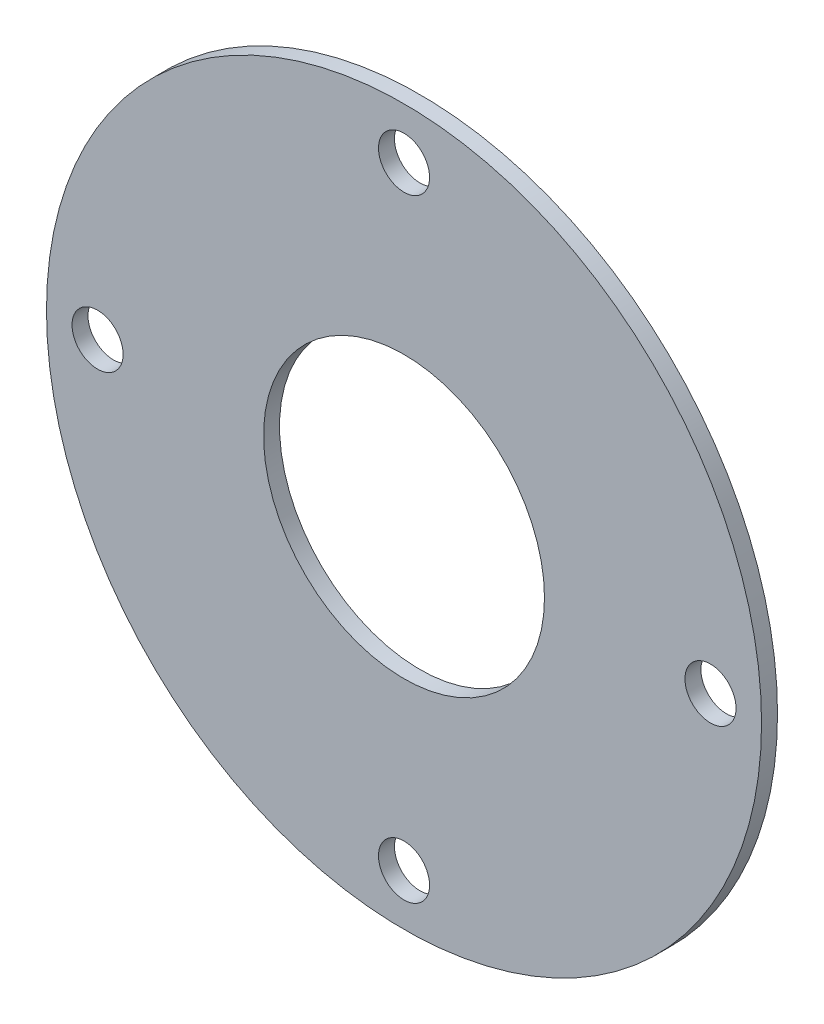
from build123d import *

# Parameters (mm, degrees)
CARRIER_REAR_START  = 32
SKETCH_1_R          = 56
SKETCH_1_R_2        = 22
CARRIER_REAR_DEPTH  = 2.5
SKETCH_2_R          = 4
THROUGH_HOLES_DEPTH = 100


with BuildPart() as part:
    # Эскиз1 → Carrier_rear (new body)
    with BuildSketch(Plane.XY.offset(CARRIER_REAR_START)):
        Circle(SKETCH_1_R)
        Circle(SKETCH_1_R_2, mode=Mode.SUBTRACT)
    extrude(amount=CARRIER_REAR_DEPTH)

    # Эскиз2 → Through_holes (cut, symmetric)
    with BuildSketch(Plane.XY):
        with Locations((48, 0)):
            Circle(SKETCH_2_R)
        with Locations((0, 48)):
            Circle(SKETCH_2_R)
        with Locations((-48, 0)):
            Circle(SKETCH_2_R)
        with Locations((0, -48)):
            Circle(SKETCH_2_R)
    extrude(amount=THROUGH_HOLES_DEPTH, both=True, mode=Mode.SUBTRACT)


solid = part.part
